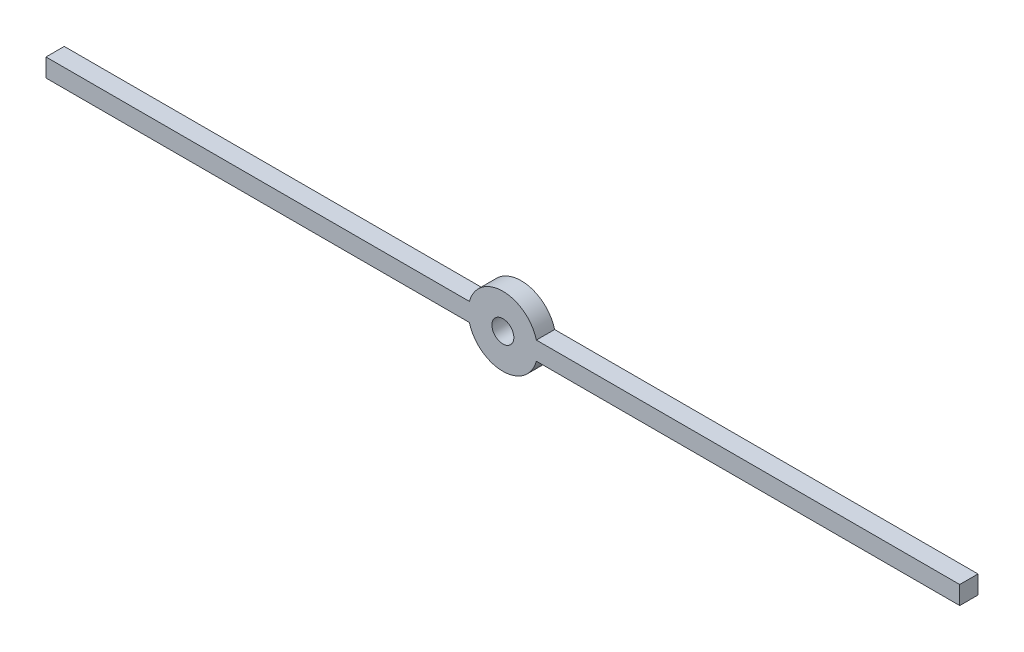
from build123d import *

# Parameters (mm, degrees)
SKETCH1_R           = 3
BOSS_EXTRUDE1_DEPTH = 5


with BuildPart() as part:
    # Sketch1 → Boss-Extrude1 (new body)
    with BuildSketch(Plane.XY):
        with BuildLine():
            Line((-125, -2.5), (-9.16515139, -2.5))
            ThreePointArc((-9.16515139, -2.5), (0, -9.5), (9.16515139, -2.5))
            Line((9.16515139, -2.5), (125, -2.5))
            Line((125, -2.5), (125, 2.5))
            Line((125, 2.5), (9.16515139, 2.5))
            ThreePointArc((9.16515139, 2.5), (0, 9.5), (-9.16515139, 2.5))
            Line((-9.16515139, 2.5), (-125, 2.5))
            Line((-125, 2.5), (-125, -2.5))
        make_face()
        Circle(SKETCH1_R, mode=Mode.SUBTRACT)
    extrude(amount=BOSS_EXTRUDE1_DEPTH)


solid = part.part
